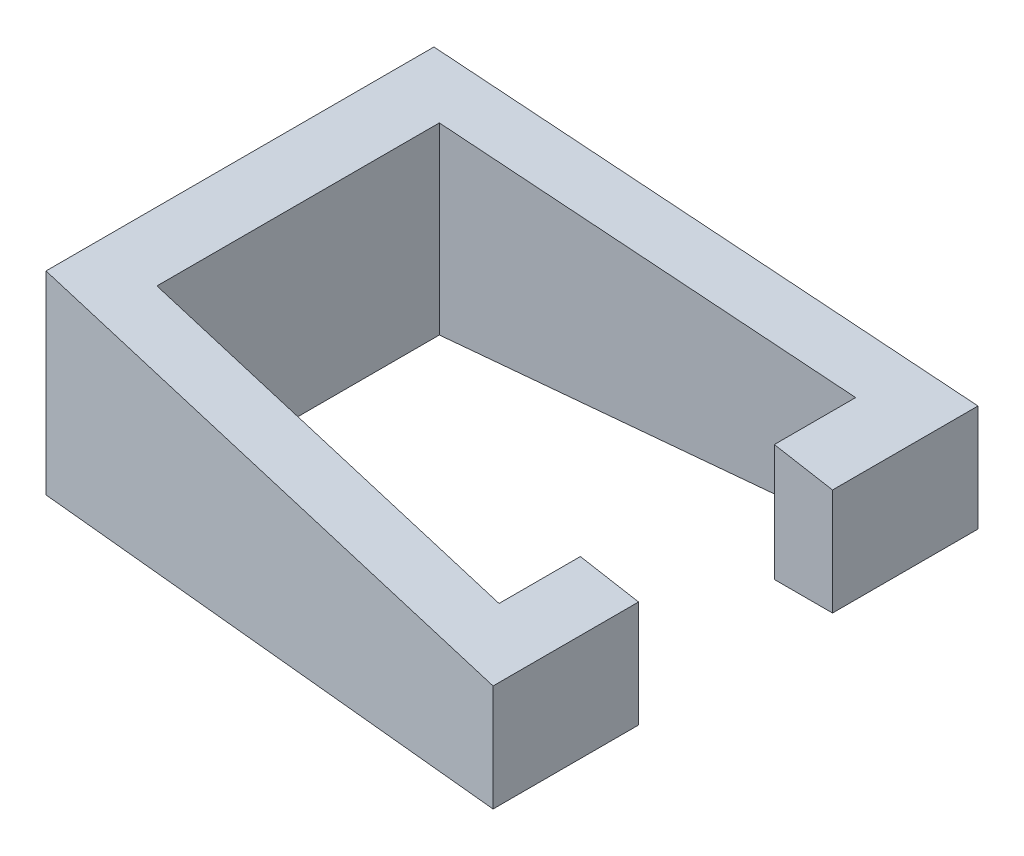
from build123d import *

# Parameters (mm, degrees)
BOSS_EXTRUDE1_DEPTH     = 15
CUT_EXTRUDE1_DEPTH      = 25.488909851
CUT_EXTRUDE1_DEPTH_BACK = 25.488909851


with BuildPart() as part:
    # Sketch1 → Boss-Extrude1 (new body)
    with BuildSketch(Plane(origin=(0, 0, 0), x_dir=(1, 0, 0), z_dir=(0, 1, 0))):
        Polygon((-10.767691547, 0), (-10.767691547, -10), (14.780280975, -12.5), (14.780280975, -5), (11.780280975, -5), (11.780280975, -9.192105414), (-7.767691547, -7.279236153), (-7.767691547, 0), (-7.767691547, 7.279236153), (11.780280975, 9.192105414), (11.780280975, 5), (14.780280975, 5), (14.780280975, 12.5), (-10.767691547, 10), align=None)
    extrude(amount=BOSS_EXTRUDE1_DEPTH)

    # Sketch2 → Cut-Extrude1 (cut, two sides: drawn at the far end of the back side and taken through both)
    with BuildSketch(Plane.XY.offset(-CUT_EXTRUDE1_DEPTH_BACK)):
        Polygon((14.780280975, 15), (14.780280975, 5.495203142), (-10.767691547, 10), (-10.767691547, 15), align=None)
    extrude(amount=CUT_EXTRUDE1_DEPTH + CUT_EXTRUDE1_DEPTH_BACK, mode=Mode.SUBTRACT)


solid = part.part
